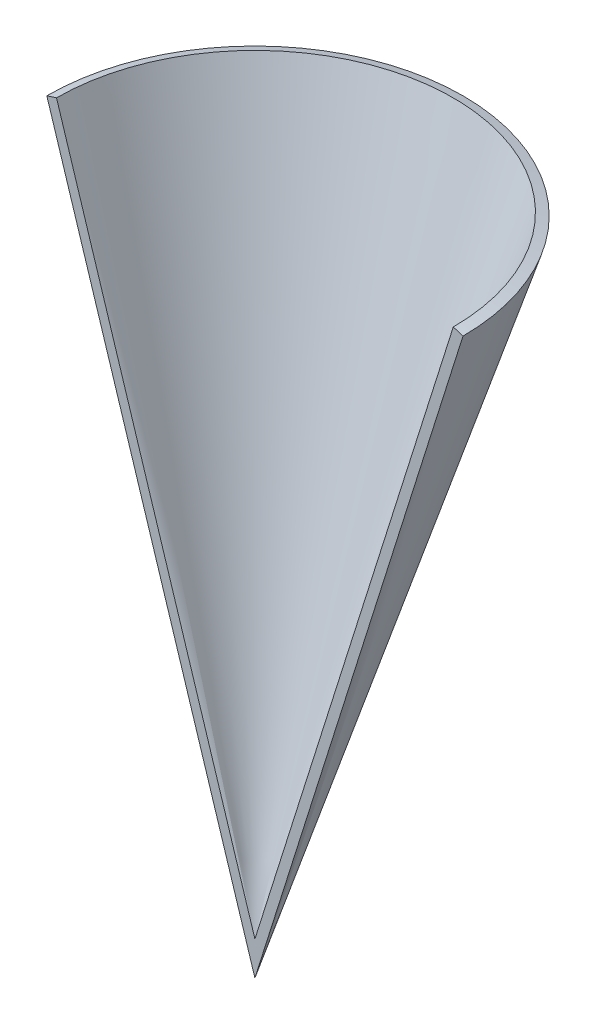
from build123d import *

# Parameters (mm, degrees)
REVOLUCI_N1_ANGLE = 180


with BuildPart() as part:
    # Croquis1 → Revolución1 (revolve)
    with BuildSketch(Plane.XY):
        Polygon((0, 0), (0, 6.651019047), (39.028344285, 130.433112926), (40.935778186, 129.831701327), align=None)
    revolve(axis=Axis((0, 0, 0), (0, 1, 0)), revolution_arc=REVOLUCI_N1_ANGLE)


solid = part.part
